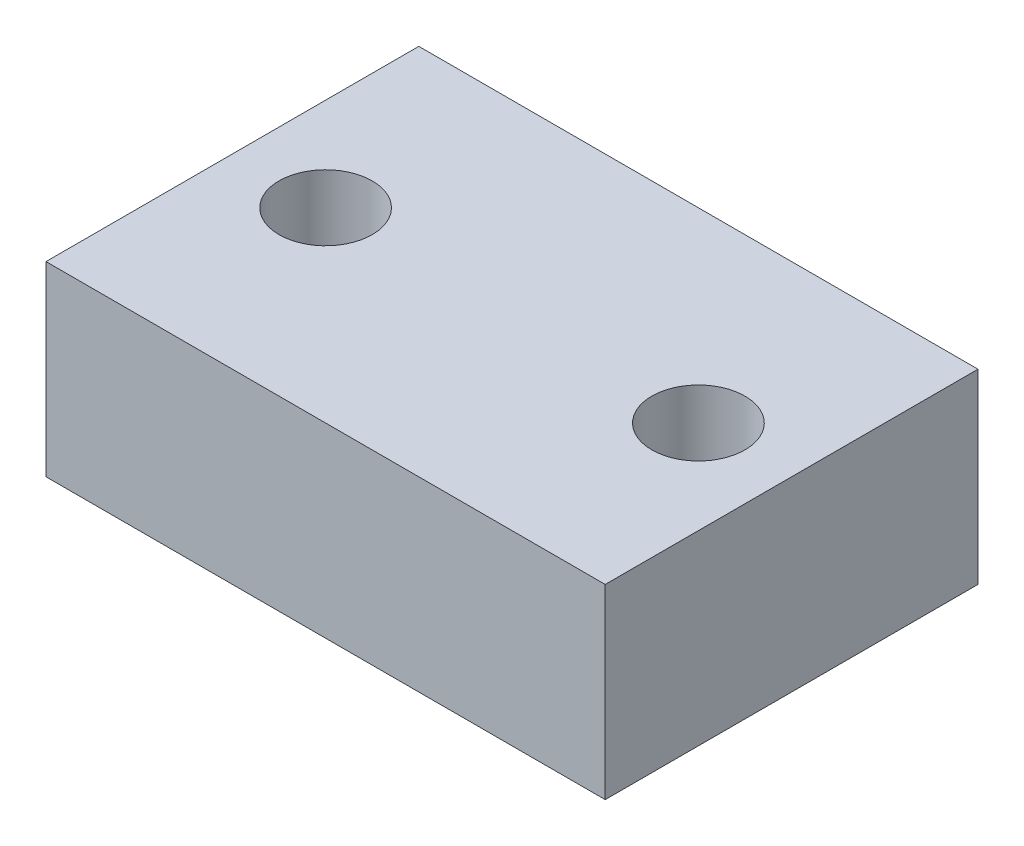
from build123d import *

# Parameters (mm, degrees)
SKETCH1_W           = 60
SKETCH1_H           = 40
BOSS_EXTRUDE1_DEPTH = 20
SKETCH2_R           = 5
CUT_EXTRUDE1_DEPTH  = 42.231056256


with BuildPart() as part:
    # Sketch1 → Boss-Extrude1 (new body)
    with BuildSketch(Plane(origin=(0, 0, 0), x_dir=(1, 0, 0), z_dir=(0, 1, 0))):
        Rectangle(SKETCH1_W, SKETCH1_H)
    extrude(amount=BOSS_EXTRUDE1_DEPTH)

    # Sketch2 → Cut-Extrude1 (cut, through all)
    with BuildSketch(Plane(origin=(0, 20, 0), x_dir=(1, 0, 0), z_dir=(0, 1, 0))):
        with Locations(Location((20, 0, 0), (0, 0, 270))):
            Circle(SKETCH2_R)
    cut_extrude1 = extrude(amount=-CUT_EXTRUDE1_DEPTH, mode=Mode.SUBTRACT)

    # Mirror1: Cut-Extrude1 across plane
    add(cut_extrude1.mirror(Plane(origin=(0, 0, 0), x_dir=(0, 0, 1), z_dir=(1, 0, 0))), mode=Mode.SUBTRACT)


solid = part.part
